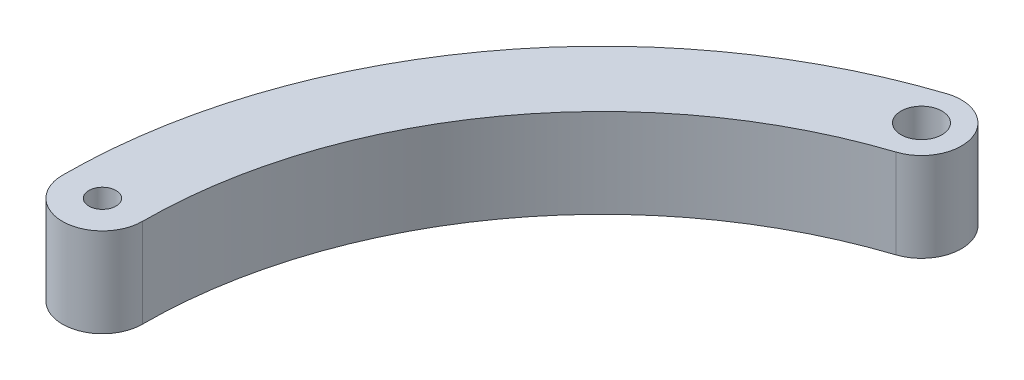
from build123d import *

# Parameters (mm, degrees)
SKETCH1_R           = 0.9921875
SKETCH1_R_2         = 1.5
BOSS_EXTRUDE1_DEPTH = 6.51002


with BuildPart() as part:
    # Sketch1 → Boss-Extrude1 (new body)
    with BuildSketch(Plane(origin=(0, 0, 0), x_dir=(1, 0, 0), z_dir=(0, 1, 0))):
        with BuildLine():
            ThreePointArc((-33.590510807, 0), (-27.195497439, 19.716169387), (-10.445442396, 31.925149168))
            ThreePointArc((-10.445442396, 31.925149168), (-8.576954256, 35.610904689), (-12.262709777, 37.479392829))
            ThreePointArc((-12.262709777, 37.479392829), (-31.926890188, 23.146330613), (-39.434489193, 0))
            ThreePointArc((-39.434489193, 0), (-36.5125, -2.921989193), (-33.590510807, 0))
        make_face()
        with Locations(Location((-36.5125, 0, 0), (0, 0, 270))):
            Circle(SKETCH1_R, mode=Mode.SUBTRACT)
        with Locations(Location((-11.354076087, 34.702270999, 0), (0, 0, 270))):
            Circle(SKETCH1_R_2, mode=Mode.SUBTRACT)
    extrude(amount=BOSS_EXTRUDE1_DEPTH)


solid = part.part
